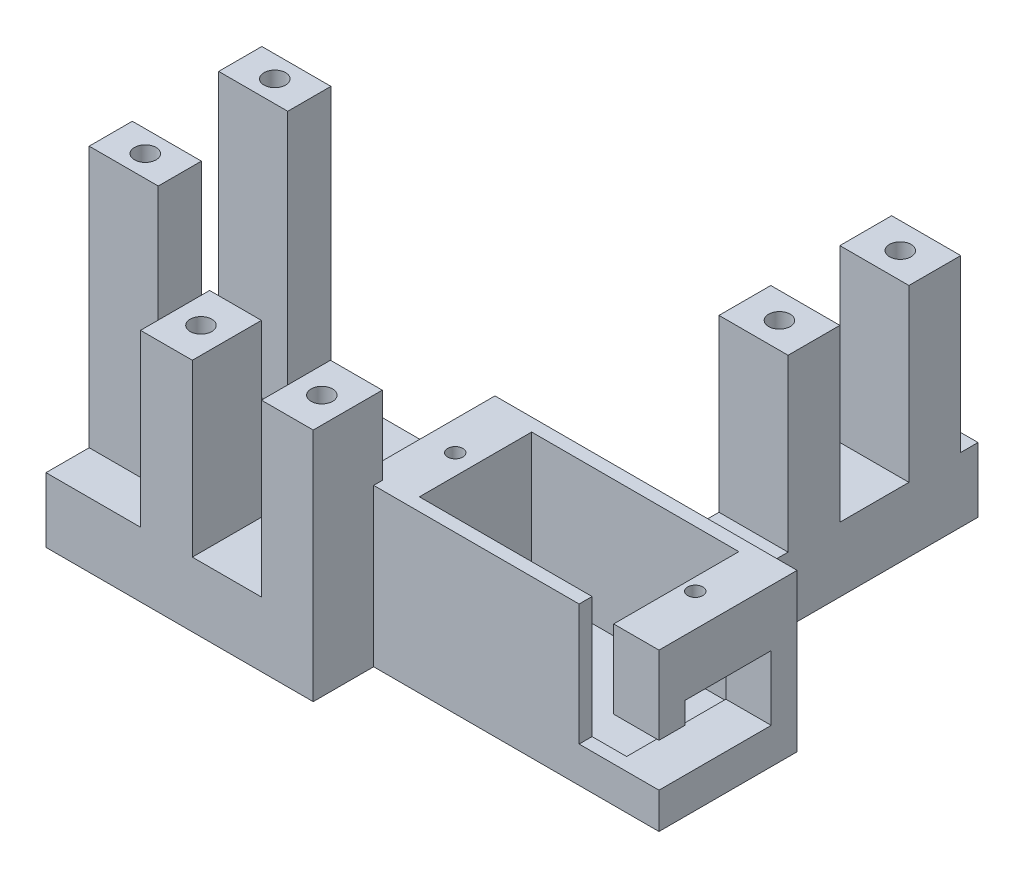
from build123d import *

# Parameters (mm, degrees)
SKETCH1_W                       = 70
SKETCH1_H                       = 50
BOSS_EXTRUDE1_DEPTH             = 7.5
SKETCH2_W                       = 35
SKETCH2_H                       = 16
BOSS_EXTRUDE2_DEPTH             = 10.7
SKETCH3_W                       = 24
SKETCH3_H                       = 13
CUT_EXTRUDE1_DEPTH              = 15.7
SKETCH4_R                       = 0.875
CUT_EXTRUDE2_DEPTH              = 8
SKETCH9_W                       = 70
SKETCH9_H                       = 7.5
BOSS_EXTRUDE10_DEPTH            = 7
SKETCH10_W                      = 8
SKETCH10_H                      = 20
SKETCH10_W_2                    = 20
SKETCH10_H_2                    = 8
BOSS_EXTRUDE11_DEPTH            = 19.75
SKETCH14_W                      = 8
SKETCH14_H                      = 8
CUT_EXTRUDE4_DEPTH              = 19.75
TAP_DRILL_FOR_M3X0_5_TAP1_D     = 2.5
TAP_DRILL_FOR_M3X0_5_TAP1_DEPTH = 5
TAP_DRILL_FOR_M3X0_5_TAP1_TIP   = 0.751075774
SKETCH6_W                       = 8
SKETCH6_H                       = 20
BOSS_EXTRUDE8_DEPTH             = 30.25
SKETCH19_W                      = 8
SKETCH19_H                      = 10
CUT_EXTRUDE6_DEPTH              = 30.25
TAP_DRILL_FOR_M3X0_5_TAP3_D     = 2.5
TAP_DRILL_FOR_M3X0_5_TAP3_DEPTH = 5
TAP_DRILL_FOR_M3X0_5_TAP3_TIP   = 0.751075774
SKETCH22_W                      = 13.05
SKETCH22_H                      = 34
SKETCH22_W_2                    = 33.05
SKETCH22_H_2                    = 7
CUT_EXTRUDE7_DEPTH              = 7.5
CUT_EXTRUDE8_DEPTH              = 42.95
SKETCH25_W                      = 10
SKETCH25_H                      = 7.5
CUT_EXTRUDE9_DEPTH              = 5.25
SKETCH26_W                      = 4
SKETCH26_H                      = 14.05
CUT_EXTRUDE10_DEPTH             = 1.5
SKETCH27_W                      = 5.25
SKETCH27_H                      = 5
CUT_EXTRUDE11_DEPTH             = 3


with BuildPart() as part:
    # Sketch1 → Boss-Extrude1 (new body)
    with BuildSketch(Plane(origin=(0, 0, 0), x_dir=(1, 0, 0), z_dir=(0, 1, 0))):
        Rectangle(SKETCH1_W, SKETCH1_H)
    extrude(amount=BOSS_EXTRUDE1_DEPTH)

    # Sketch2 → Boss-Extrude2 (add)
    with BuildSketch(Plane(origin=(0, 7.5, 0), x_dir=(1, 0, 0), z_dir=(0, 1, 0))):
        with Locations((17.5, -17)):
            Rectangle(SKETCH2_W, SKETCH2_H)
    extrude(amount=BOSS_EXTRUDE2_DEPTH)

    # Sketch3 → Cut-Extrude1 (cut)
    with BuildSketch(Plane(origin=(0, 18.2, 0), x_dir=(1, 0, 0), z_dir=(0, 1, 0))):
        with Locations((17.75, -17)):
            Rectangle(SKETCH3_W, SKETCH3_H)
    extrude(amount=-CUT_EXTRUDE1_DEPTH, mode=Mode.SUBTRACT)

    # Sketch4 → Cut-Extrude2 (cut)
    with BuildSketch(Plane(origin=(0, 18.2, 0), x_dir=(1, 0, 0), z_dir=(0, 1, 0))):
        with Locations(Location((3.4, -17, 0), (0, 0, 270))):
            Circle(SKETCH4_R)
        with Locations(Location((31.2, -17, 0), (0, 0, 270))):
            Circle(SKETCH4_R)
    extrude(amount=-CUT_EXTRUDE2_DEPTH, mode=Mode.SUBTRACT)

    # Sketch9 → Boss-Extrude10 (add)
    with BuildSketch(Plane.XY.offset(25)):
        with Locations((0, 3.75)):
            Rectangle(SKETCH9_W, SKETCH9_H)
    extrude(amount=BOSS_EXTRUDE10_DEPTH)

    # Sketch10 → Boss-Extrude11 (add)
    with BuildSketch(Plane(origin=(0, 7.5, 0), x_dir=(1, 0, 0), z_dir=(0, 1, 0))):
        with Locations((17.95, 13)):
            Rectangle(SKETCH10_W, SKETCH10_H)
        with Locations((-8.05, -28)):
            Rectangle(SKETCH10_W_2, SKETCH10_H_2)
    extrude(amount=BOSS_EXTRUDE11_DEPTH)

    # Sketch14 → Cut-Extrude4 (cut)
    with BuildSketch(Plane(origin=(0, 27.25, 0), x_dir=(1, 0, 0), z_dir=(0, 1, 0))):
        with Locations((-8.05, -28)):
            Rectangle(SKETCH14_W, SKETCH14_H)
        with Locations((17.95, 13)):
            Rectangle(SKETCH14_W, SKETCH14_H)
    extrude(amount=-CUT_EXTRUDE4_DEPTH, mode=Mode.SUBTRACT)

    # Tap Drill for M3x0.5 Tap1
    with Locations(Plane(origin=(-15.05, 27.25, 28), x_dir=(0, 0, 1), z_dir=(0, 1, 0))):
        with Locations((0, 0), (0, 14), (-34, 33), (-48, 33)):
            Hole(TAP_DRILL_FOR_M3X0_5_TAP1_D / 2, depth=TAP_DRILL_FOR_M3X0_5_TAP1_DEPTH)
            with Locations((0, 0, -(TAP_DRILL_FOR_M3X0_5_TAP1_DEPTH + TAP_DRILL_FOR_M3X0_5_TAP1_TIP / 2))):  # 118° drill point
                Cone(0, TAP_DRILL_FOR_M3X0_5_TAP1_D / 2, TAP_DRILL_FOR_M3X0_5_TAP1_TIP, mode=Mode.SUBTRACT)

    # Sketch6 → Boss-Extrude8 (add)
    with BuildSketch(Plane(origin=(0, 7.5, 0), x_dir=(1, 0, 0), z_dir=(0, 1, 0))):
        with Locations((-25, -17)):
            Rectangle(SKETCH6_W, SKETCH6_H)
    extrude(amount=BOSS_EXTRUDE8_DEPTH)

    # Sketch19 → Cut-Extrude6 (cut)
    with BuildSketch(Plane(origin=(0, 37.75, 0), x_dir=(1, 0, 0), z_dir=(0, 1, 0))):
        with Locations((-25, -17)):
            Rectangle(SKETCH19_W, SKETCH19_H)
    extrude(amount=-CUT_EXTRUDE6_DEPTH, mode=Mode.SUBTRACT)

    # Tap Drill for M3x0.5 Tap3
    with Locations(Plane(origin=(-25, 37.75, 9.5), x_dir=(0, 0, 1), z_dir=(0, 1, 0))):
        with Locations((0, 0), (15, 0)):
            Hole(TAP_DRILL_FOR_M3X0_5_TAP3_D / 2, depth=TAP_DRILL_FOR_M3X0_5_TAP3_DEPTH)
            with Locations((0, 0, -(TAP_DRILL_FOR_M3X0_5_TAP3_DEPTH + TAP_DRILL_FOR_M3X0_5_TAP3_TIP / 2))):  # 118° drill point
                Cone(0, TAP_DRILL_FOR_M3X0_5_TAP3_D / 2, TAP_DRILL_FOR_M3X0_5_TAP3_TIP, mode=Mode.SUBTRACT)

    # Sketch22 → Cut-Extrude7 (cut)
    with BuildSketch(Plane(origin=(0, 7.5, 0), x_dir=(1, 0, 0), z_dir=(0, 1, 0))):
        Polygon((13.95, -7), (13.95, 25), (-35, 25), (-35, -32), (-29, -32), (-29, -7), align=None)
        with Locations((28.475, 8)):
            Rectangle(SKETCH22_W, SKETCH22_H)
        with Locations((18.475, -28.5)):
            Rectangle(SKETCH22_W_2, SKETCH22_H_2)
    extrude(amount=-CUT_EXTRUDE7_DEPTH, mode=Mode.SUBTRACT)

    # Sketch24 → Cut-Extrude8 (cut)
    with BuildSketch(Plane.ZY.offset(29)):
        Polygon((7, 2.5), (9.5, 2.5), (9.5, 6), (7.5, 6), (7.5, 5), (7, 5), align=None)
    extrude(amount=-CUT_EXTRUDE8_DEPTH, mode=Mode.SUBTRACT)

    # Sketch25 → Cut-Extrude9 (cut)
    with BuildSketch(Plane.ZY.offset(-29.75)):
        with Locations((17, 7.9)):
            Rectangle(SKETCH25_W, SKETCH25_H)
    extrude(amount=-CUT_EXTRUDE9_DEPTH, mode=Mode.SUBTRACT)

    # Sketch26 → Cut-Extrude10 (cut)
    with BuildSketch(Plane.XY.offset(25)):
        with Locations((27.75, 11.175)):
            Rectangle(SKETCH26_W, SKETCH26_H)
    extrude(amount=-CUT_EXTRUDE10_DEPTH, mode=Mode.SUBTRACT)

    # Sketch27 → Cut-Extrude11 (cut)
    with BuildSketch(Plane.XY.offset(25)):
        with Locations((32.375, 6.65)):
            Rectangle(SKETCH27_W, SKETCH27_H)
    extrude(amount=-CUT_EXTRUDE11_DEPTH, mode=Mode.SUBTRACT)


solid = part.part
